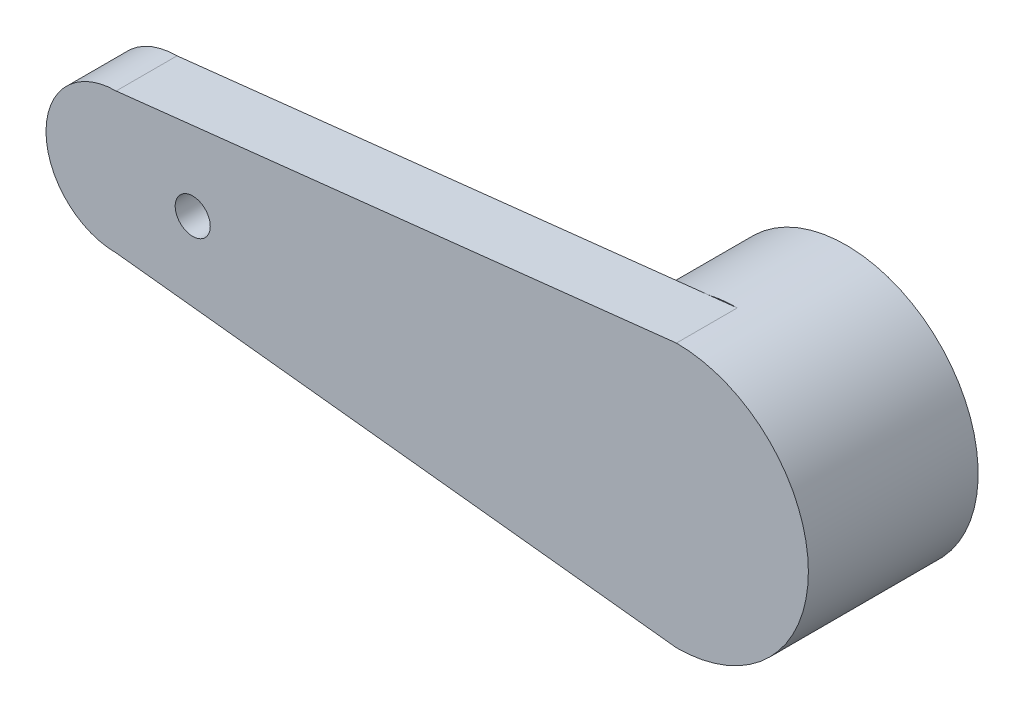
from build123d import *

# Parameters (mm, degrees)
BOSS_EXTRUDE1_DEPTH = 1.65
BOSS_EXTRUDE2_START = 2.95
SKETCH2_R           = 3.575
BOSS_EXTRUDE2_DEPTH = 2.95
SKETCH3_R           = 2.3
CUT_EXTRUDE1_DEPTH  = 2.95
SKETCH4_R           = 0.475
CUT_EXTRUDE2_DEPTH  = 1.65


with BuildPart() as part:
    # Sketch1 → Boss-Extrude1 (new body)
    with BuildSketch(Plane.XY):
        with BuildLine():
            Line((-15.178752219, 1.9), (0, 3.575))
            ThreePointArc((0, 3.575), (3.575, 0), (0, -3.575))
            Line((0, -3.575), (-15.178752219, -1.9))
            ThreePointArc((-15.178752219, -1.9), (-17.078752219, 0), (-15.178752219, 1.9))
        make_face()
    extrude(amount=BOSS_EXTRUDE1_DEPTH)

    # Sketch2 → Boss-Extrude2 (add)
    with BuildSketch(Plane(origin=(0, 0, 0), x_dir=(-1, 0, 0), z_dir=(0, 0, -1)).offset(BOSS_EXTRUDE2_START)):
        Circle(SKETCH2_R)
    extrude(amount=-BOSS_EXTRUDE2_DEPTH)

    # Sketch3 → Cut-Extrude1 (cut)
    with BuildSketch(Plane(origin=(0, 0, -2.95), x_dir=(-1, 0, 0), z_dir=(0, 0, -1))):
        Circle(SKETCH3_R)
    extrude(amount=-CUT_EXTRUDE1_DEPTH, mode=Mode.SUBTRACT)

    # Sketch4 → Cut-Extrude2 (cut)
    with BuildSketch(Plane.XY.offset(1.65)):
        with Locations((-13.103752219, 0)):
            Circle(SKETCH4_R)
    extrude(amount=-CUT_EXTRUDE2_DEPTH, mode=Mode.SUBTRACT)


solid = part.part
